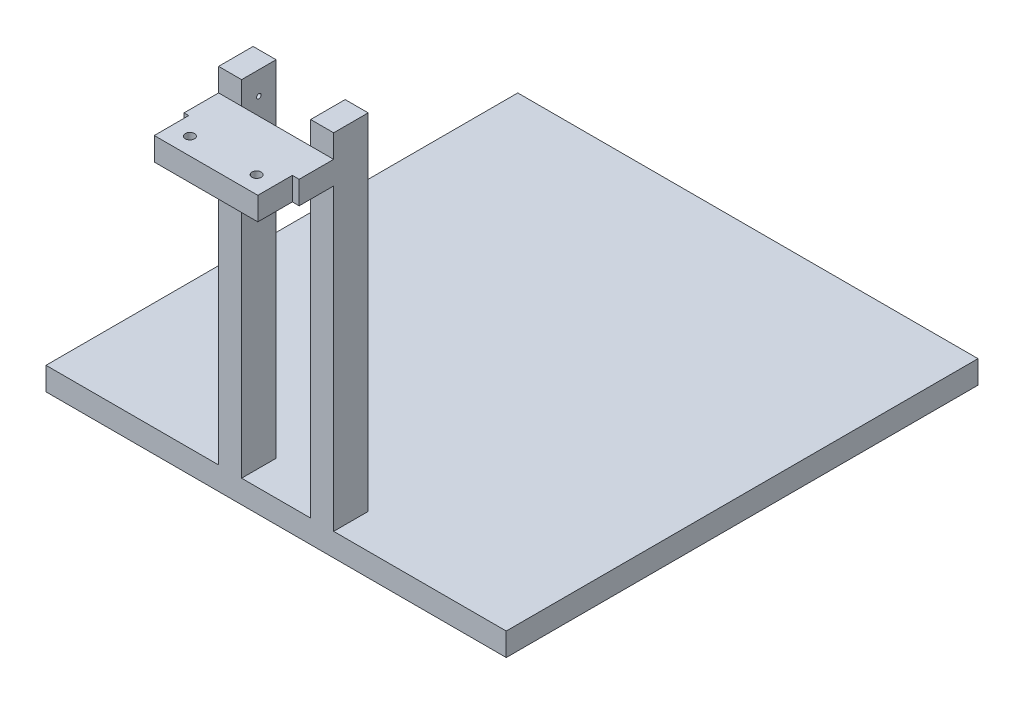
from build123d import *

# Parameters (mm, degrees)
SKETCH1_W           = 200
SKETCH1_H           = 205
BOSS_EXTRUDE1_DEPTH = 10
SKETCH2_W           = 10
SKETCH2_H           = 15
BOSS_EXTRUDE2_DEPTH = 160
SKETCH4_W           = 50
SKETCH4_H           = 10
BOSS_EXTRUDE3_DEPTH = 15
SKETCH5_W           = 45
SKETCH5_H           = 10
BOSS_EXTRUDE4_DEPTH = 15
SKETCH6_R           = 2
CUT_EXTRUDE1_DEPTH  = 15
SKETCH10_R          = 1
CUT_EXTRUDE2_DEPTH  = 5
CUT_EXTRUDE3_START  = 5
SKETCH7_R           = 1
CUT_EXTRUDE3_DEPTH  = 5


with BuildPart() as part:
    # Sketch1 → Boss-Extrude1 (new body)
    with BuildSketch(Plane(origin=(0, 0, 0), x_dir=(1, 0, 0), z_dir=(0, 1, 0))):
        Rectangle(SKETCH1_W, SKETCH1_H)
    extrude(amount=BOSS_EXTRUDE1_DEPTH)

    # Sketch2 → Boss-Extrude2 (add)
    with BuildSketch(Plane(origin=(0, 0, 0), x_dir=(1, 0, 0), z_dir=(0, 1, 0))):
        with Locations((-20, -95)):
            Rectangle(SKETCH2_W, SKETCH2_H)
        with Locations((20, -95)):
            Rectangle(SKETCH2_W, SKETCH2_H)
    extrude(amount=BOSS_EXTRUDE2_DEPTH)

    # Sketch4 → Boss-Extrude3 (add)
    with BuildSketch(Plane.XY.offset(102.5)):
        with Locations((0, 145)):
            Rectangle(SKETCH4_W, SKETCH4_H)
    extrude(amount=BOSS_EXTRUDE3_DEPTH)

    # Sketch5 → Boss-Extrude4 (add)
    with BuildSketch(Plane.XY.offset(117.5)):
        with Locations((-0.452584592, 145)):
            Rectangle(SKETCH5_W, SKETCH5_H)
    extrude(amount=BOSS_EXTRUDE4_DEPTH)

    # Sketch6 → Cut-Extrude1 (cut)
    with BuildSketch(Plane(origin=(0, 150, 0), x_dir=(1, 0, 0), z_dir=(0, 1, 0))):
        with Locations(Location((-14.952584592, -125, 0), (0, 0, 270))):
            Circle(SKETCH6_R)
        with Locations(Location((14.047415408, -125, 0), (0, 0, 270))):
            Circle(SKETCH6_R)
    extrude(amount=-CUT_EXTRUDE1_DEPTH, mode=Mode.SUBTRACT)

    # Sketch10 → Cut-Extrude2 (cut)
    with BuildSketch(Plane(origin=(-15, 0, 0), x_dir=(0, 0, -1), z_dir=(1, 0, 0))):
        with Locations((-95, 150)):
            Circle(SKETCH10_R)
    extrude(amount=-CUT_EXTRUDE2_DEPTH, mode=Mode.SUBTRACT)

    # Sketch7 → Cut-Extrude3 (cut)
    with BuildSketch(Plane(origin=(15, 0, 0), x_dir=(0, 0, -1), z_dir=(1, 0, 0)).offset(CUT_EXTRUDE3_START)):
        with Locations((-95, 150)):
            Circle(SKETCH7_R)
    extrude(amount=-CUT_EXTRUDE3_DEPTH, mode=Mode.SUBTRACT)


solid = part.part
